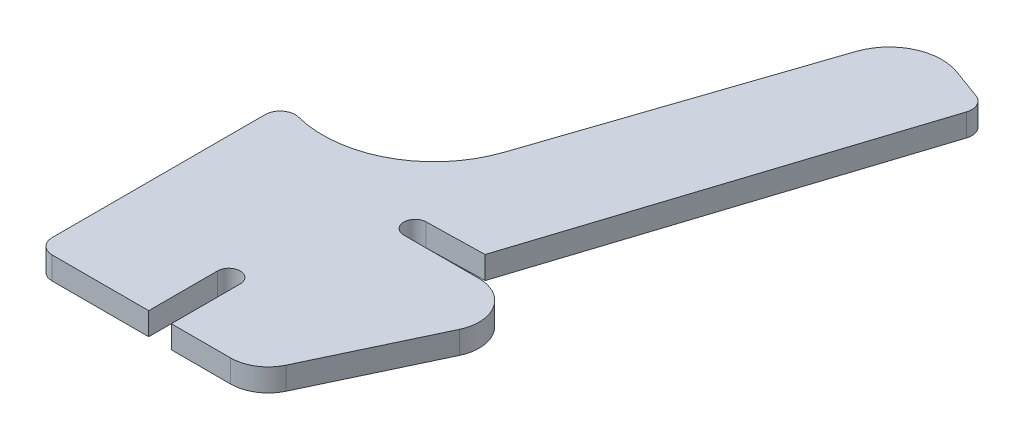
from build123d import *

# Parameters (mm, degrees)
BOSS_EXTRUDE1_DEPTH = 3
FILLET1_R           = 5
FILLET2_R           = 2
FILLET3_R           = 7
FILLET4_R           = 2
FILLET5_R           = 5


with BuildPart() as part:
    # Sketch1 → Boss-Extrude1 (new body)
    with BuildSketch(Plane(origin=(0, 0, 0), x_dir=(1, 0, 0), z_dir=(0, 1, 0))):
        with BuildLine():
            Line((0, 33.06), (0, 0))
            Line((0, 0), (14.8, 0))
            Line((14.8, 0), (14.8, 9.13))
            ThreePointArc((14.8, 9.13), (16.3, 10.63), (17.8, 9.13))
            Line((17.8, 9.13), (17.8, 0))
            Line((17.8, 0), (28.82, 0))
            Line((28.82, 0), (40.93, 25.6))
            Line((40.93, 25.6), (23.039915269, 25.6))
            ThreePointArc((23.039915269, 25.6), (21.54, 27.084056775), (23.00803062, 28.599661085))
            Line((23.00803062, 28.599661085), (30.66, 28.762351413))
            Line((30.66, 28.762351413), (46.79, 78.9))
            Line((46.79, 78.9), (34.22, 83.484702826))
            Line((34.22, 83.484702826), (20.171354305, 41.75831525))
            ThreePointArc((20.171354305, 41.75831525), (12.025034014, 32.911797705), (0, 33.06))
        make_face()
    extrude(amount=BOSS_EXTRUDE1_DEPTH)

    # Fillet1
    fillet1_edges = [part.edges().sort_by_distance(p)[0] for p in [
        (40.93, 1.5, -25.6),
    ]]
    fillet(fillet1_edges, radius=FILLET1_R)

    # Fillet2
    fillet2_edges = [part.edges().sort_by_distance(p)[0] for p in [
        (0, 1.5, -33.06),
    ]]
    fillet(fillet2_edges, radius=FILLET2_R)

    # Fillet3
    fillet3_edges = [part.edges().sort_by_distance(p)[0] for p in [
        (34.22, 1.5, -83.484702826),
    ]]
    fillet(fillet3_edges, radius=FILLET3_R)

    # Fillet4
    fillet4_edges = [part.edges().sort_by_distance(p)[0] for p in [
        (0, 1.5, 0),
        (46.79, 1.5, -78.9),
    ]]
    fillet(fillet4_edges, radius=FILLET4_R)

    # Fillet5
    fillet5_edges = [part.edges().sort_by_distance(p)[0] for p in [
        (28.82, 1.5, 0),
    ]]
    fillet(fillet5_edges, radius=FILLET5_R)


solid = part.part
